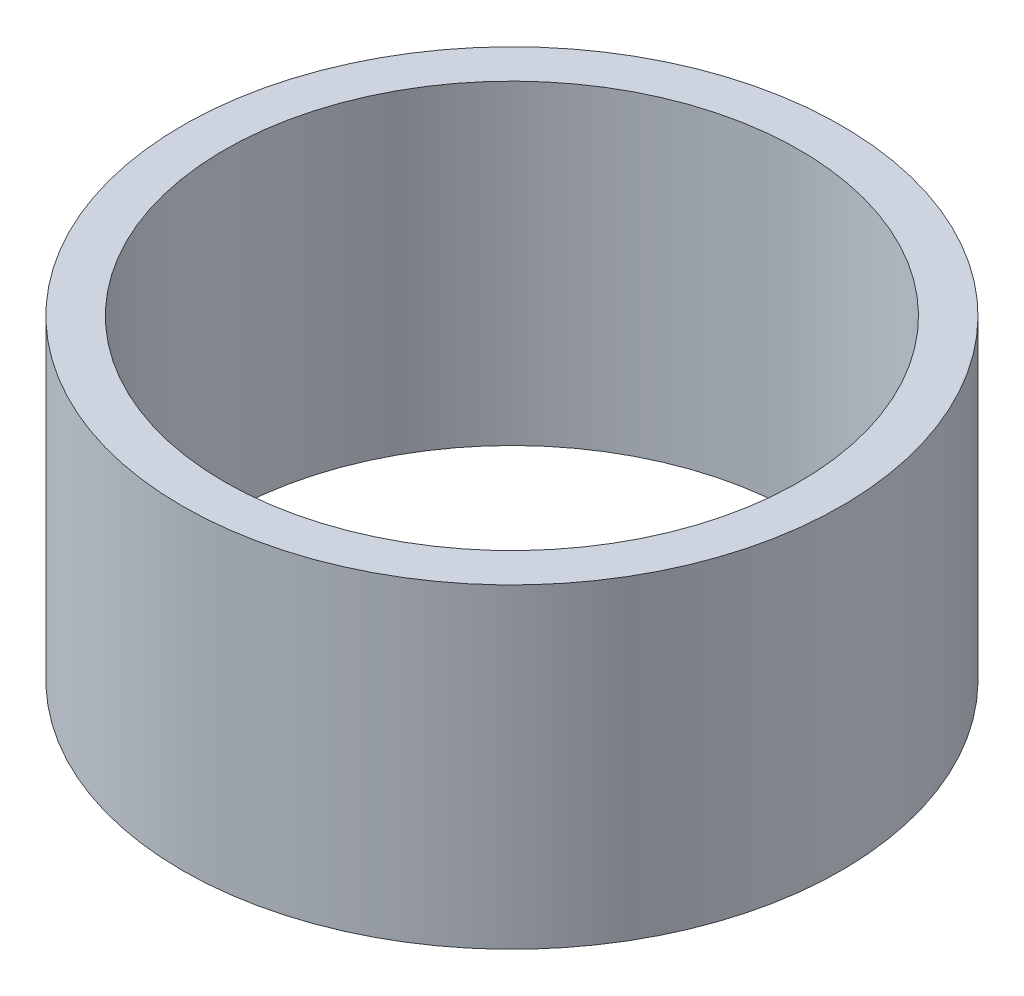
from build123d import *

# Parameters (mm, degrees)
ESQUISSE1_W = 3
ESQUISSE1_H = 22.5


with BuildPart() as part:
    # Esquisse1 → Révolution1 (revolve)
    with BuildSketch(Plane.XY, mode=Mode.PRIVATE) as r_volution1_sk:
        with Locations((22, 11.25)):
            Rectangle(ESQUISSE1_W, ESQUISSE1_H)
    revolve(r_volution1_sk.sketch.rotate(Axis((0, 28.120065129, 0), (0, -1, 0)), 90), axis=Axis((0, 28.120065129, 0), (0, -1, 0)))


solid = part.part
